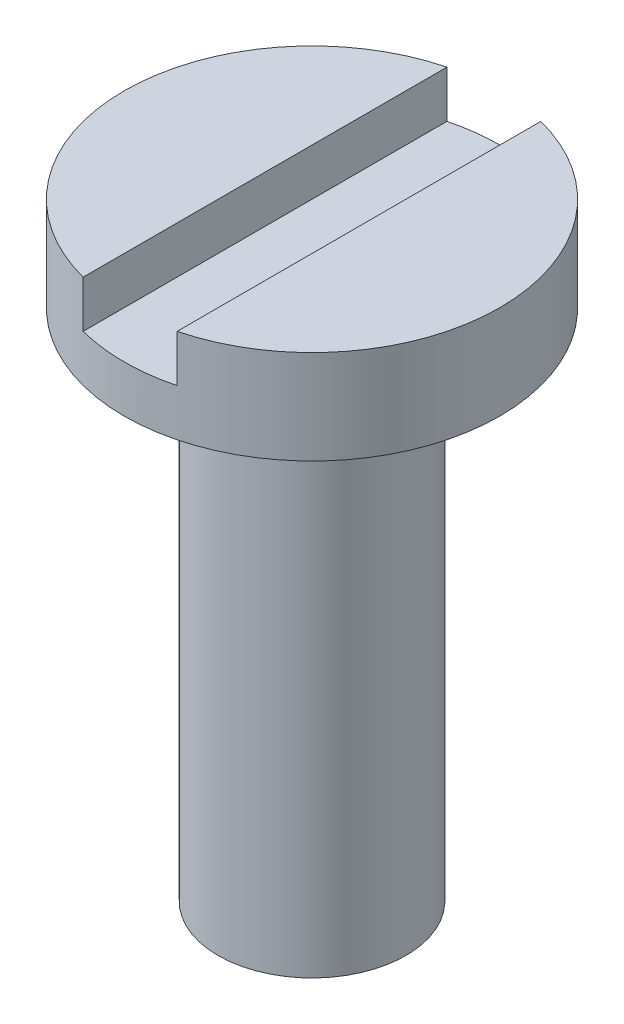
from build123d import *

# Parameters (mm, degrees)
ENL_V_MAT_EXTRU_1_DEPTH      = 11.597633257
ENL_V_MAT_EXTRU_1_DEPTH_BACK = 11.597633257
ESQUISSE2_W                  = 1.5
ESQUISSE2_H                  = 0.75


with BuildPart() as part:
    # Esquisse1 → Révolution1 (revolve)
    with BuildSketch(Plane.XY, mode=Mode.PRIVATE) as r_volution1_sk:
        Polygon((0, 0), (0, 9.711324865), (3, 9.711324865), (3, 8.211324865), (1.5, 8.211324865), (1.5, 0), (1, -0.288675135), (0, -0.288675135), align=None)
    revolve(r_volution1_sk.sketch.rotate(Axis((0, 0, 0), (0, 1, 0)), 90), axis=Axis((0, 0, 0), (0, 1, 0)))

    # Esquisse2 → Enlèv. mat.-Extru.1 (cut, two sides: drawn at the far end of the back side and taken through both)
    with BuildSketch(Plane.XY.offset(-ENL_V_MAT_EXTRU_1_DEPTH_BACK)):
        with Locations((0, 9.336324865)):
            Rectangle(ESQUISSE2_W, ESQUISSE2_H)
    extrude(amount=ENL_V_MAT_EXTRU_1_DEPTH + ENL_V_MAT_EXTRU_1_DEPTH_BACK, mode=Mode.SUBTRACT)


solid = part.part
